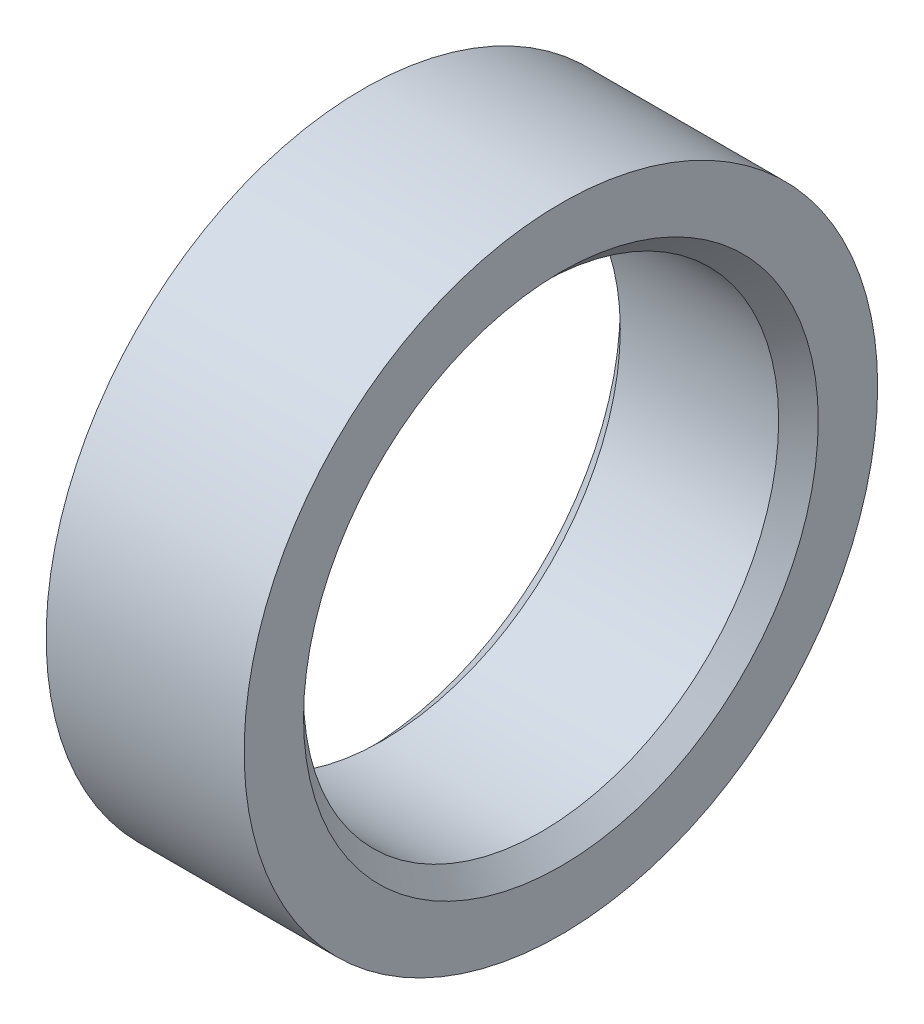
from build123d import *

# Parameters (mm, degrees)
SZKIC1_R                    = 8
SZKIC1_R_2                  = 6
DODANIE_WYCI_GNI_CIE1_DEPTH = 5
SFAZOWANIE1_SIZE            = 0.5


with BuildPart() as part:
    # Szkic1 → Dodanie-wyciągnięcie1 (new body)
    with BuildSketch(Plane(origin=(0, 0, 0), x_dir=(0, 0, -1), z_dir=(1, 0, 0))):
        Circle(SZKIC1_R)
        Circle(SZKIC1_R_2, mode=Mode.SUBTRACT)
    extrude(amount=DODANIE_WYCI_GNI_CIE1_DEPTH)

    # Sfazowanie1
    sfazowanie1_edges = [part.edges().sort_by_distance(p)[0] for p in [
        (0, 0, 6),
        (5, 0, 6),
    ]]
    chamfer(sfazowanie1_edges, length=SFAZOWANIE1_SIZE)


solid = part.part
